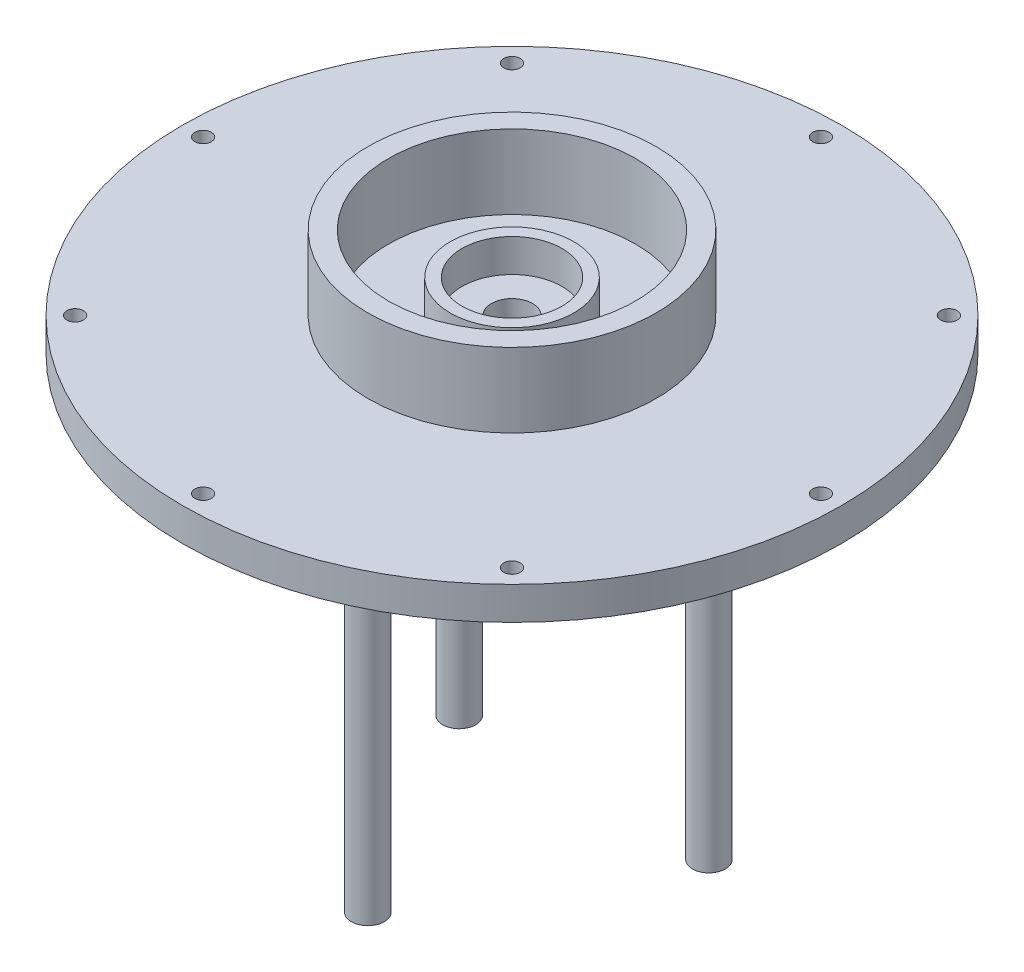
from build123d import *

# Parameters (mm, degrees)
CROQUIS1_R              = 80
CROQUIS1_R_2            = 5
SALIENTE_EXTRUIR1_DEPTH = 8
CROQUIS2_R              = 2
CORTAR_EXTRUIR1_DEPTH   = 10
CROQUIS3_R              = 35
CROQUIS3_R_2            = 30
CROQUIS3_R_3            = 15
CROQUIS3_R_4            = 12.15
SALIENTE_EXTRUIR2_DEPTH = 8
CROQUIS4_R              = 35
CROQUIS4_R_2            = 30
SALIENTE_EXTRUIR3_DEPTH = 10
CROQUIS5_R              = 4
SALIENTE_EXTRUIR4_DEPTH = 100


with BuildPart() as part:
    # Croquis1 → Saliente-Extruir1 (new body)
    with BuildSketch(Plane(origin=(0, 0, 0), x_dir=(1, 0, 0), z_dir=(0, 1, 0))):
        with Locations(Location((0, 0, 0), (0, 0, 270))):
            Circle(CROQUIS1_R)
        with Locations(Location((0, 0, 0), (0, 0, 270))):
            Circle(CROQUIS1_R_2, mode=Mode.SUBTRACT)
    extrude(amount=SALIENTE_EXTRUIR1_DEPTH)

    # Croquis2 → Cortar-Extruir1 (cut)
    with BuildSketch(Plane(origin=(0, 8, 0), x_dir=(1, 0, 0), z_dir=(0, 1, 0))):
        with Locations(Location((0, 75, 0), (0, 0, 270))):
            Circle(CROQUIS2_R)
        with Locations(Location((53.033008589, 53.033008589, 0), (0, 0, 270))):
            Circle(CROQUIS2_R)
        with Locations(Location((75, 0, 0), (0, 0, 270))):
            Circle(CROQUIS2_R)
        with Locations(Location((53.033008589, -53.033008589, 0), (0, 0, 270))):
            Circle(CROQUIS2_R)
        with Locations(Location((0, -75, 0), (0, 0, 270))):
            Circle(CROQUIS2_R)
        with Locations(Location((-53.033008589, -53.033008589, 0), (0, 0, 270))):
            Circle(CROQUIS2_R)
        with Locations(Location((-75, 0, 0), (0, 0, 270))):
            Circle(CROQUIS2_R)
        with Locations(Location((-53.033008589, 53.033008589, 0), (0, 0, 270))):
            Circle(CROQUIS2_R)
    extrude(amount=-CORTAR_EXTRUIR1_DEPTH, mode=Mode.SUBTRACT)

    # Croquis3 → Saliente-Extruir2 (add)
    # profile 1 of 2: a face of its own
    with BuildSketch(Plane(origin=(0, 8, 0), x_dir=(1, 0, 0), z_dir=(0, 1, 0))):
        with Locations(Location((0, 0, 0), (0, 0, 270))):
            Circle(CROQUIS3_R)
        with Locations(Location((0, 0, 0), (0, 0, 270))):
            Circle(CROQUIS3_R_2, mode=Mode.SUBTRACT)
    # profile 2 of 2: a face of its own
    with BuildSketch(Plane(origin=(0, 8, 0), x_dir=(1, 0, 0), z_dir=(0, 1, 0))):
        with Locations(Location((0, 0, 0), (0, 0, 270))):
            Circle(CROQUIS3_R_3)
        with Locations(Location((0, 0, 0), (0, 0, 270))):
            Circle(CROQUIS3_R_4, mode=Mode.SUBTRACT)
    extrude(amount=SALIENTE_EXTRUIR2_DEPTH)

    # Croquis4 → Saliente-Extruir3 (add)
    with BuildSketch(Plane(origin=(0, 16, 0), x_dir=(1, 0, 0), z_dir=(0, 1, 0))):
        with Locations(Location((0, 0, 0), (0, 0, 270))):
            Circle(CROQUIS4_R)
        with Locations(Location((0, 0, 0), (0, 0, 270))):
            Circle(CROQUIS4_R_2, mode=Mode.SUBTRACT)
    extrude(amount=SALIENTE_EXTRUIR3_DEPTH)

    # Croquis5 → Saliente-Extruir4 (add)
    with BuildSketch(Plane.XZ):
        with Locations(Location((0, 35, 0), (0, 0, 90))):
            Circle(CROQUIS5_R)
        with Locations(Location((30.310889132, -17.5, 0), (0, 0, 90))):
            Circle(CROQUIS5_R)
        with Locations(Location((-30.310889132, -17.5, 0), (0, 0, 90))):
            Circle(CROQUIS5_R)
    extrude(amount=SALIENTE_EXTRUIR4_DEPTH)


solid = part.part
